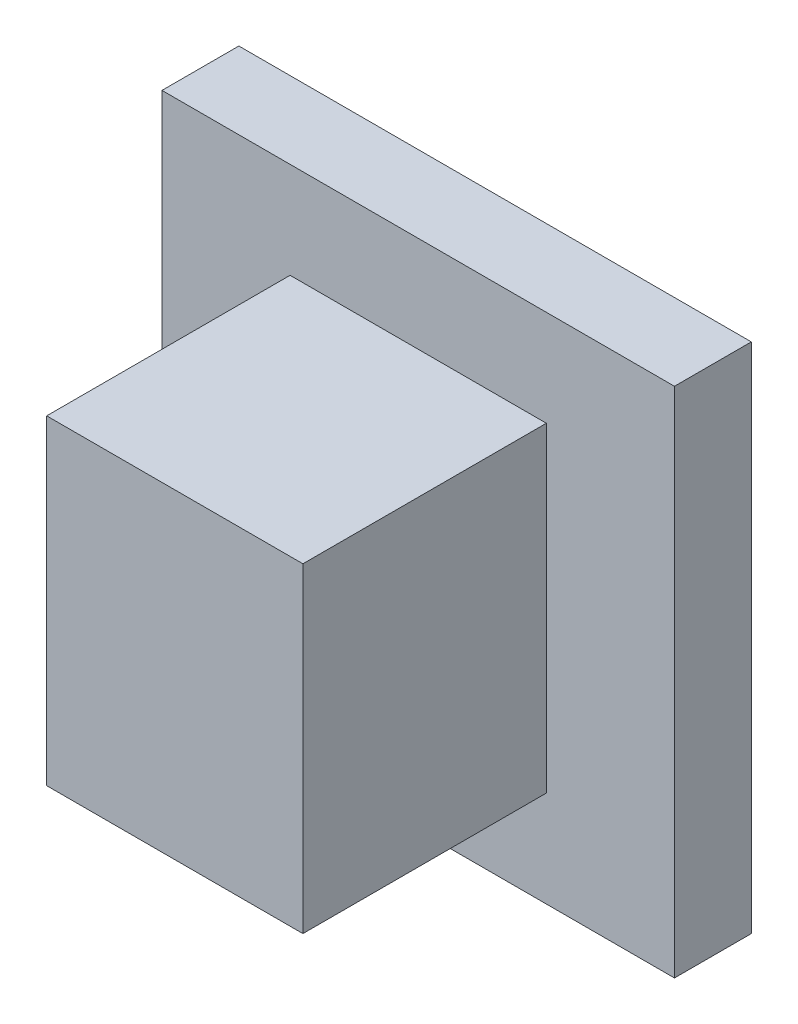
from build123d import *

# Parameters (mm, degrees)
SKETCH_1_W      = 4
SKETCH_1_H      = 5
SKETCH_1_W_2    = 2
SKETCH_1_H_2    = 3
EXTRUDE_1_DEPTH = 4
EXTRUDE_2_DEPTH = 1.2
SKETCH_3_W      = 4
SKETCH_3_H      = 5
EXTRUDE_3_DEPTH = 1
SKETCH_4_W      = 2
SKETCH_4_H      = 8
EXTRUDE_4_DEPTH = 1.2


with BuildPart() as part:
    # 草图1 → 凸台-拉伸1 (new body)
    with BuildSketch(Plane.XY):
        with Locations((1, 1.5)):
            Rectangle(SKETCH_1_W, SKETCH_1_H)
        with Locations((1, 1.5)):
            Rectangle(SKETCH_1_W_2, SKETCH_1_H_2, mode=Mode.SUBTRACT)
    extrude(amount=EXTRUDE_1_DEPTH)

    # 草图2 → 凸台-拉伸2 (add)
    with BuildSketch(Plane(origin=(0, 0, 0), x_dir=(-1, 0, 0), z_dir=(0, 0, -1))):
        Polygon((-3, 4), (1, 4), (1, -1), (-3, -1), (-3, -2.5), (3, -2.5), (3, 5.5), (-3, 5.5), align=None)
    extrude(amount=-EXTRUDE_2_DEPTH)

    # 草图3 → 凸台-拉伸3 (add)
    with BuildSketch(Plane.XY.offset(4)):
        with Locations((1, 1.5)):
            Rectangle(SKETCH_3_W, SKETCH_3_H)
    extrude(amount=EXTRUDE_3_DEPTH)

    # 草图4 → 凸台-拉伸4 (add)
    with BuildSketch(Plane.XY.offset(1.2)):
        with Locations((4, 1.5)):
            Rectangle(SKETCH_4_W, SKETCH_4_H)
    extrude(amount=-EXTRUDE_4_DEPTH)


solid = part.part
